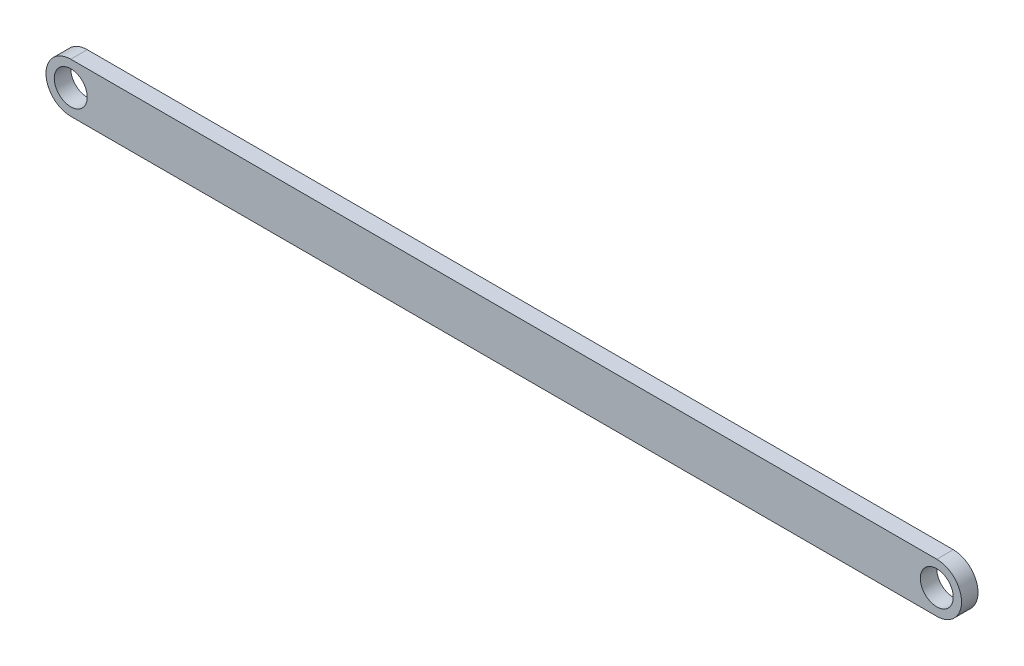
from build123d import *

# Parameters (mm, degrees)
EXTRUDE_2_DEPTH     = 10
SKETCH_2_R          = 10
CUT_EXTRUDE_1_DEPTH = 10


with BuildPart() as part:
    # Эскиз1 → Бобышка-Вытянуть2 (new body)
    with BuildSketch(Plane.XY):
        with BuildLine():
            Line((0, 0), (-525, 0))
            ThreePointArc((-525, 0), (-540, 15), (-525, 30))
            Line((-525, 30), (0, 30))
            ThreePointArc((0, 30), (15, 15), (0, 0))
        make_face()
    extrude(amount=EXTRUDE_2_DEPTH)

    # Эскиз2 → Вырез-Вытянуть1 (cut)
    with BuildSketch(Plane(origin=(0, 0, 0), x_dir=(-1, 0, 0), z_dir=(0, 0, -1))):
        with Locations((0, 15)):
            Circle(SKETCH_2_R)
        with Locations((525, 15)):
            Circle(SKETCH_2_R)
    extrude(amount=-CUT_EXTRUDE_1_DEPTH, mode=Mode.SUBTRACT)


solid = part.part
